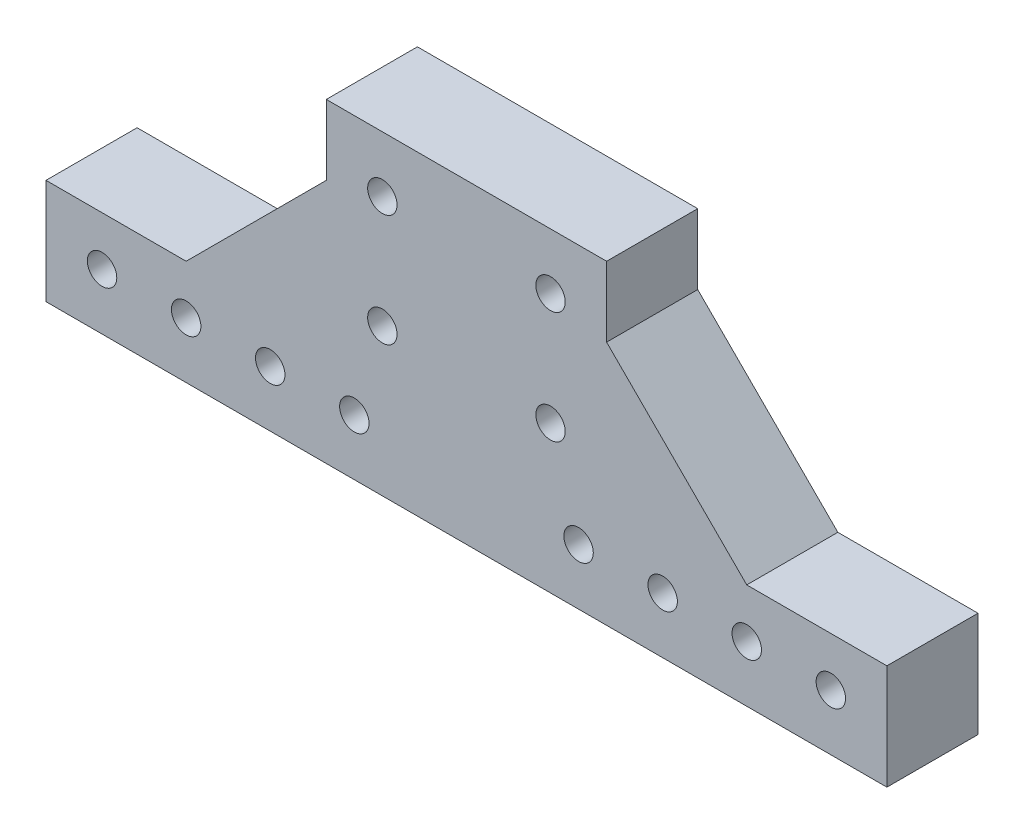
from build123d import *

# Parameters (mm, degrees)
EXTRUDE_1_DEPTH     = 13
SKETCH_2_R          = 2.1
CUT_EXTRUDE_1_DEPTH = 3
SKETCH_3_R          = 2.1
CUT_EXTRUDE_2_DEPTH = 129.817700647


with BuildPart() as part:
    # 草图1 → 凸台-拉伸1 (new body)
    with BuildSketch(Plane.XY):
        Polygon((0, 0), (120, 0), (120, 15), (100, 15), (80, 35), (80, 45), (40, 45), (40, 35), (20, 15), (0, 15), align=None)
    extrude(amount=EXTRUDE_1_DEPTH)

    # 草图2 → 切除-拉伸1 (cut)
    with BuildSketch(Plane.XY.offset(13)):
        with Locations((48, 37)):
            Circle(SKETCH_2_R)
        with Locations((72, 37)):
            Circle(SKETCH_2_R)
        with Locations((48, 21)):
            Circle(SKETCH_2_R)
        with Locations((72, 21)):
            Circle(SKETCH_2_R)
        with Locations((8, 8)):
            Circle(SKETCH_2_R)
        with Locations((20, 8)):
            Circle(SKETCH_2_R)
        with Locations((100, 8)):
            Circle(SKETCH_2_R)
        with Locations((112, 8)):
            Circle(SKETCH_2_R)
    extrude(amount=-CUT_EXTRUDE_1_DEPTH, mode=Mode.SUBTRACT)

    # 草图3 → 切除-拉伸2 (cut, through all)
    with BuildSketch(Plane.XY.offset(13)):
        with Locations((32, 8)):
            Circle(SKETCH_3_R)
        with Locations((44, 8)):
            Circle(SKETCH_3_R)
        with Locations((76, 8)):
            Circle(SKETCH_3_R)
        with Locations((88, 8)):
            Circle(SKETCH_3_R)
    extrude(amount=-CUT_EXTRUDE_2_DEPTH, mode=Mode.SUBTRACT)


solid = part.part
